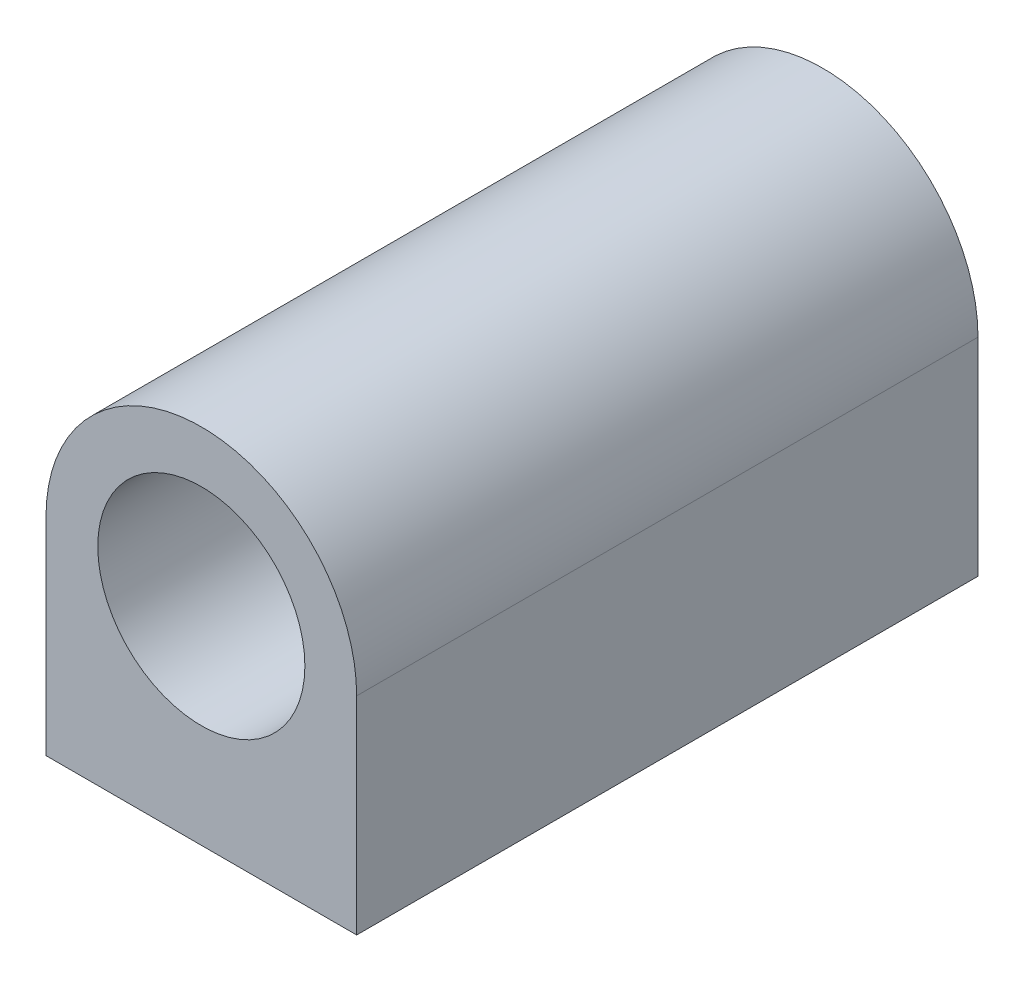
from build123d import *

# Parameters (mm, degrees)
SKETCH1_R            = 12.7
BOSS_EXTRUDE1_DEPTH  = 38.1
HOLE1_D              = 3.302
HOLE1_DEPTH          = 12.7
LPATTERN1_COUNT      = 2
LPATTERN1_PITCH      = 63.5
LPATTERN1_COUNT_DIR2 = 2
LPATTERN1_PITCH_DIR2 = 25.4


with BuildPart() as part:
    # Sketch1 → Boss-Extrude1 (new, symmetric)
    with BuildSketch(Plane.XY):
        with BuildLine():
            Line((-19.05, 25.4), (-19.05, 0))
            Line((-19.05, 0), (19.05, 0))
            Line((19.05, 0), (19.05, 25.4))
            ThreePointArc((19.05, 25.4), (0, 44.45), (-19.05, 25.4))
        make_face()
        with Locations(Location((0, 25.4, 0), (0, 0, 180))):
            Circle(SKETCH1_R, mode=Mode.SUBTRACT)
    extrude(amount=BOSS_EXTRUDE1_DEPTH, both=True)

    # Hole1
    with Locations(Plane(origin=(0, 0, 0), x_dir=(-1, 0, 0), z_dir=(0, -1, 0))):
        with Locations((-12.7, 31.75)):
            hole1 = Hole(HOLE1_D / 2, depth=HOLE1_DEPTH)

    # LPattern1: Hole1 2 × 2
    with Locations(*[(-j * LPATTERN1_PITCH_DIR2, 0, i * LPATTERN1_PITCH) for i in range(LPATTERN1_COUNT) for j in range(LPATTERN1_COUNT_DIR2) if (i, j) != (0, 0)]):
        add(hole1, mode=Mode.SUBTRACT)


solid = part.part
